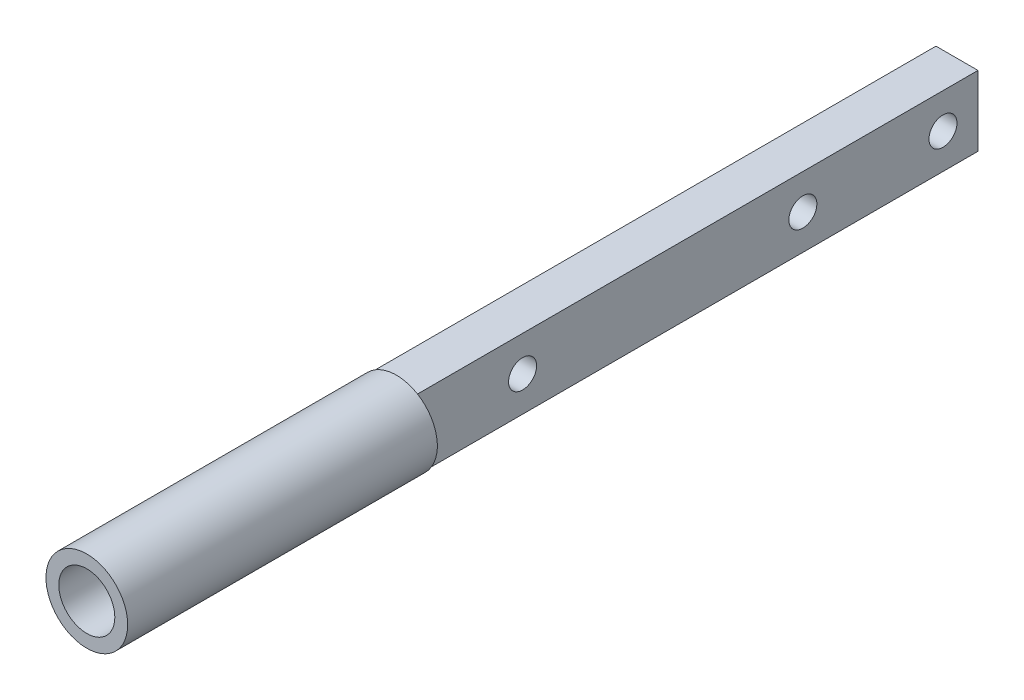
from build123d import *

# Parameters (mm, degrees)
ESQUISSE1_W             = 30
ESQUISSE1_H             = 50
BOSS_EXTRU_1_DEPTH      = 400
ESQUISSE2_R             = 29.154759474
BOSS_EXTRU_2_DEPTH      = 221
ESQUISSE3_R             = 20
ENL_V_MAT_EXTRU_1_DEPTH = 195
ENL_V_MAT_EXTRU_2_REACH = 625.25
ESQUISSE4_R             = 10


with BuildPart() as part:
    # Esquisse1 → Boss.-Extru.1 (new body)
    with BuildSketch(Plane.XY):
        Rectangle(ESQUISSE1_W, ESQUISSE1_H)
    extrude(amount=BOSS_EXTRU_1_DEPTH)

    # Esquisse2 → Boss.-Extru.2 (add)
    with BuildSketch(Plane.XY.offset(400)):
        with Locations(Location((0, 0, 0), (0, 0, 120.963756532))):
            Circle(ESQUISSE2_R)
    extrude(amount=BOSS_EXTRU_2_DEPTH)

    # Esquisse3 → Enlèv. mat.-Extru.1 (cut)
    with BuildSketch(Plane.XY.offset(621)):
        Circle(ESQUISSE3_R)
    extrude(amount=-ENL_V_MAT_EXTRU_1_DEPTH, mode=Mode.SUBTRACT)

    # Esquisse4 → Enlèv. mat.-Extru.2 (cut, up to next)
    with BuildSketch(Plane(origin=(15, 0, 0), x_dir=(0, 0, -1), z_dir=(1, 0, 0)), mode=Mode.PRIVATE) as enl_v_mat_extru_2_sk1:
        with Locations(Location((-25, 0, 0), (0, 0, 90))):
            Circle(ESQUISSE4_R)
    enl_v_mat_extru_2_tool1 = extrude(enl_v_mat_extru_2_sk1.sketch, amount=-ENL_V_MAT_EXTRU_2_REACH, mode=Mode.PRIVATE) & part.part
    # Esquisse4 → Enlèv. mat.-Extru.2 (cut, up to next)
    with BuildSketch(Plane(origin=(15, 0, 0), x_dir=(0, 0, -1), z_dir=(1, 0, 0)), mode=Mode.PRIVATE) as enl_v_mat_extru_2_sk2:
        with Locations(Location((-125, 0, 0), (0, 0, 90))):
            Circle(ESQUISSE4_R)
    enl_v_mat_extru_2_tool2 = extrude(enl_v_mat_extru_2_sk2.sketch, amount=-ENL_V_MAT_EXTRU_2_REACH, mode=Mode.PRIVATE) & part.part
    # Esquisse4 → Enlèv. mat.-Extru.2 (cut, up to next)
    with BuildSketch(Plane(origin=(15, 0, 0), x_dir=(0, 0, -1), z_dir=(1, 0, 0)), mode=Mode.PRIVATE) as enl_v_mat_extru_2_sk3:
        with Locations(Location((-325, 0, 0), (0, 0, 90))):
            Circle(ESQUISSE4_R)
    enl_v_mat_extru_2_tool3 = extrude(enl_v_mat_extru_2_sk3.sketch, amount=-ENL_V_MAT_EXTRU_2_REACH, mode=Mode.PRIVATE) & part.part
    add(enl_v_mat_extru_2_tool1.solids().sort_by_distance((15, 0, 25))[0], mode=Mode.SUBTRACT)
    add(enl_v_mat_extru_2_tool2.solids().sort_by_distance((15, 0, 125))[0], mode=Mode.SUBTRACT)
    add(enl_v_mat_extru_2_tool3.solids().sort_by_distance((15, 0, 325))[0], mode=Mode.SUBTRACT)


solid = part.part
